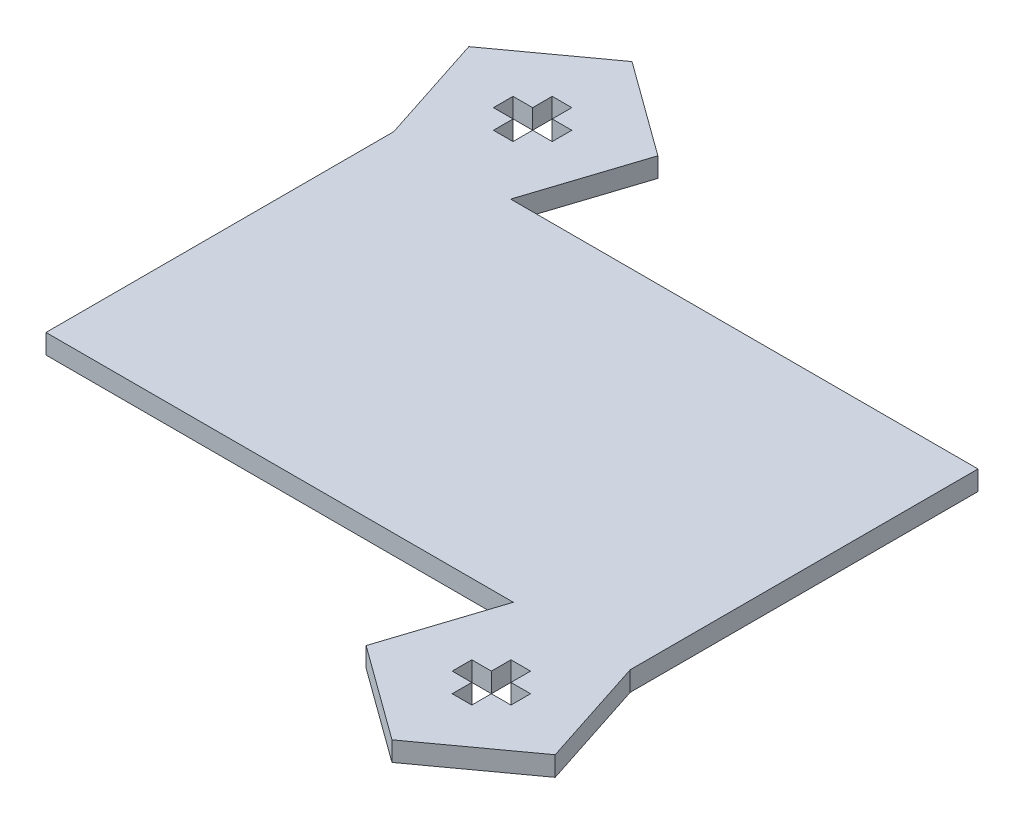
from build123d import *

# Parameters (mm, degrees)
BOSS_EXTRUDE1_DEPTH = 5.08


with BuildPart() as part:
    # Sketch1 → Boss-Extrude1 (new body)
    with BuildSketch(Plane(origin=(0, 0, 0), x_dir=(1, 0, 0), z_dir=(0, 1, 0))):
        Polygon((-74.783670705, 36.824993776), (-74.783670705, -53.334846224), (46.37500358, -53.334846224), (37.014119661, -82.142609318), (61.519803774, -99.947823692), (86.026241778, -82.14364696), (76.666369295, -53.334846224), (76.666369295, 36.824993776), (-44.491630705, 36.824993776), (-35.131758222, 65.633794512), (-59.638196226, 83.437971244), (-84.143880339, 65.63275687), align=None)
        Polygon((-59.637650705, 65.290773776), (-57.097650705, 65.290773776), (-57.097650705, 60.210773776), (-52.017650705, 60.210773776), (-52.017650705, 57.670773776), (-52.017650705, 55.130773776), (-57.097650705, 55.130773776), (-57.097650705, 50.050773776), (-59.637650705, 50.050773776), (-62.177650705, 50.050773776), (-62.177650705, 55.130773776), (-67.257650705, 55.130773776), (-67.257650705, 57.670773776), (-67.257650705, 60.210773776), (-62.177650705, 60.210773776), (-62.177650705, 65.290773776), align=None, mode=Mode.SUBTRACT)
        Polygon((69.140349295, -74.180626224), (69.140349295, -76.720626224), (64.060349295, -76.720626224), (64.060349295, -81.800626224), (61.520349295, -81.800626224), (58.980349295, -81.800626224), (58.980349295, -76.720626224), (53.900349295, -76.720626224), (53.900349295, -74.180626224), (53.900349295, -71.640626224), (58.980349295, -71.640626224), (58.980349295, -66.560626224), (61.520349295, -66.560626224), (64.060349295, -66.560626224), (64.060349295, -71.640626224), (69.140349295, -71.640626224), align=None, mode=Mode.SUBTRACT)
    extrude(amount=BOSS_EXTRUDE1_DEPTH)


solid = part.part
